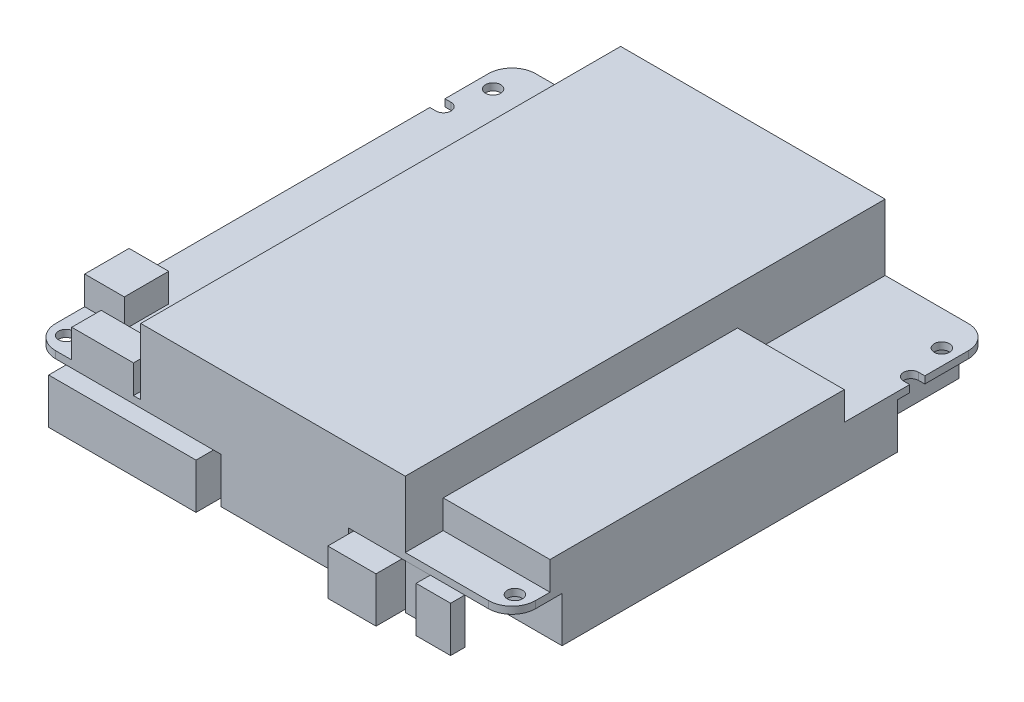
from build123d import *

# Parameters (mm, degrees)
SKETCH_1_R          = 1.6
EXTRUDE_1_DEPTH     = 1.5
SKETCH_2_W          = 56
SKETCH_2_H          = 101.6
EXTRUDE_2_DEPTH     = 14
SKETCH_3_W          = 22.6
SKETCH_3_H          = 62.30419098
SKETCH_3_W_2        = 13.073006245
SKETCH_3_H_2        = 6.218410599
SKETCH_3_W_3        = 8.391210828
SKETCH_3_H_3        = 9.399534429
EXTRUDE_3_DEPTH     = 6
SKETCH_4_W          = 6
SKETCH_4_H          = 11.3
EXTRUDE_4_DEPTH     = 13.4
SKETCH_5_W          = 1.75
SKETCH_5_H          = 8
CUT_EXTRUDE_1_DEPTH = 45
SKETCH_6_W          = 27
SKETCH_6_H          = 13
SKETCH_6_W_2        = 36
SKETCH_6_H_2        = 24
SKETCH_6_W_3        = 30
SKETCH_6_H_3        = 55
SKETCH_6_W_4        = 51
SKETCH_6_H_4        = 71
SKETCH_6_W_5        = 31.2
SKETCH_6_H_5        = 17
SKETCH_6_W_6        = 6.36
SKETCH_6_H_6        = 16
SKETCH_6_H_7        = 4
SKETCH_6_W_7        = 10.21
SKETCH_6_H_8        = 13.5
SKETCH_6_W_8        = 7.6
SKETCH_6_H_9        = 2.5
SKETCH_6_W_9        = 7.3
SKETCH_6_H_10       = 3
EXTRUDE_5_DEPTH     = 9.6


with BuildPart() as part:
    # Эскиз1 → Бобышка-Вытянуть1 (new body)
    with BuildSketch(Plane(origin=(0, 0, 0), x_dir=(1, 0, 0), z_dir=(0, 1, 0))):
        with BuildLine():
            Line((45.8, 50.8), (-45.8, 50.8))
            ThreePointArc((-45.8, 50.8), (-49.335533906, 49.335533906), (-50.8, 45.8))
            Line((-50.8, 45.8), (-50.8, 36.6))
            Line((-50.8, 36.6), (-49.5, 36.6))
            ThreePointArc((-49.5, 36.6), (-47.9, 35), (-49.5, 33.4))
            Line((-49.5, 33.4), (-50.8, 33.4))
            Line((-50.8, 33.4), (-50.8, -45.8))
            ThreePointArc((-50.8, -45.8), (-49.335533906, -49.335533906), (-45.8, -50.8))
            Line((-45.8, -50.8), (45.8, -50.8))
            ThreePointArc((45.8, -50.8), (49.335533906, -49.335533906), (50.8, -45.8))
            Line((50.8, -45.8), (50.8, 33.4))
            Line((50.8, 33.4), (49.5, 33.4))
            ThreePointArc((49.5, 33.4), (47.9, 35), (49.5, 36.6))
            Line((49.5, 36.6), (50.8, 36.6))
            Line((50.8, 36.6), (50.8, 45.8))
            ThreePointArc((50.8, 45.8), (49.335533906, 49.335533906), (45.8, 50.8))
        make_face()
        with Locations(Location((-47.5, -46.9, 0), (0, 0, 270))):
            Circle(SKETCH_1_R, mode=Mode.SUBTRACT)
        with Locations(Location((47.5, -46.9, 0), (0, 0, 270))):
            Circle(SKETCH_1_R, mode=Mode.SUBTRACT)
        with Locations(Location((-47.5, 43.5, 0), (0, 0, 270))):
            Circle(SKETCH_1_R, mode=Mode.SUBTRACT)
        with Locations(Location((47.5, 43.5, 0), (0, 0, 270))):
            Circle(SKETCH_1_R, mode=Mode.SUBTRACT)
    extrude(amount=EXTRUDE_1_DEPTH)

    # Эскиз2 → Бобышка-Вытянуть2 (add)
    with BuildSketch(Plane(origin=(0, 1.5, 0), x_dir=(1, 0, 0), z_dir=(0, 1, 0))):
        with Locations((0.2, 0)):
            Rectangle(SKETCH_2_W, SKETCH_2_H)
    extrude(amount=EXTRUDE_2_DEPTH)

    # Эскиз3 → Бобышка-Вытянуть3 (add)
    with BuildSketch(Plane(origin=(0, 1.5, 0), x_dir=(1, 0, 0), z_dir=(0, 1, 0))):
        with Locations((39.5, -11.607082664)):
            Rectangle(SKETCH_3_W, SKETCH_3_H)
        with Locations((-35.87228605, -47.690794701)):
            Rectangle(SKETCH_3_W_2, SKETCH_3_H_2)
        with Locations((-46.604394586, -34.970831235)):
            Rectangle(SKETCH_3_W_3, SKETCH_3_H_3)
    extrude(amount=EXTRUDE_3_DEPTH)

    # Эскиз4 → Бобышка-Вытянуть4 (add)
    with BuildSketch(Plane.XZ):
        with Locations((27.8, -45.15)):
            Rectangle(SKETCH_4_W, SKETCH_4_H)
    extrude(amount=EXTRUDE_4_DEPTH)

    # Эскиз5 → Вырез-Вытянуть1 (cut)
    with BuildSketch(Plane(origin=(0, 0, -50.8), x_dir=(-1, 0, 0), z_dir=(0, 0, -1))):
        with Locations((-26.531274607, 11.4)):
            Rectangle(SKETCH_5_W, SKETCH_5_H)
        with Locations((-24.581274607, 11.4)):
            Rectangle(SKETCH_5_W, SKETCH_5_H)
        with Locations((-22.631274607, 11.4)):
            Rectangle(SKETCH_5_W, SKETCH_5_H)
        with Locations((-20.681274607, 11.4)):
            Rectangle(SKETCH_5_W, SKETCH_5_H)
        with Locations((-18.731274607, 11.4)):
            Rectangle(SKETCH_5_W, SKETCH_5_H)
        with Locations((-16.781274607, 11.4)):
            Rectangle(SKETCH_5_W, SKETCH_5_H)
        with Locations((-14.831274607, 11.4)):
            Rectangle(SKETCH_5_W, SKETCH_5_H)
        with Locations((-12.881274607, 11.4)):
            Rectangle(SKETCH_5_W, SKETCH_5_H)
        with Locations((-10.931274607, 11.4)):
            Rectangle(SKETCH_5_W, SKETCH_5_H)
        with Locations((-8.981274607, 11.4)):
            Rectangle(SKETCH_5_W, SKETCH_5_H)
        with Locations((-7.031274607, 11.4)):
            Rectangle(SKETCH_5_W, SKETCH_5_H)
        with Locations((-5.081274607, 11.4)):
            Rectangle(SKETCH_5_W, SKETCH_5_H)
        with Locations((-3.131274607, 11.4)):
            Rectangle(SKETCH_5_W, SKETCH_5_H)
        with Locations((-1.181274607, 11.4)):
            Rectangle(SKETCH_5_W, SKETCH_5_H)
        with Locations((0.768725393, 11.4)):
            Rectangle(SKETCH_5_W, SKETCH_5_H)
        with Locations((2.718725393, 11.4)):
            Rectangle(SKETCH_5_W, SKETCH_5_H)
        with Locations((4.668725393, 11.4)):
            Rectangle(SKETCH_5_W, SKETCH_5_H)
        with Locations((6.618725393, 11.4)):
            Rectangle(SKETCH_5_W, SKETCH_5_H)
        with Locations((8.568725393, 11.4)):
            Rectangle(SKETCH_5_W, SKETCH_5_H)
        with Locations((10.518725393, 11.4)):
            Rectangle(SKETCH_5_W, SKETCH_5_H)
        with Locations((12.468725393, 11.4)):
            Rectangle(SKETCH_5_W, SKETCH_5_H)
        with Locations((14.418725393, 11.4)):
            Rectangle(SKETCH_5_W, SKETCH_5_H)
        with Locations((16.368725393, 11.4)):
            Rectangle(SKETCH_5_W, SKETCH_5_H)
        with Locations((18.318725393, 11.4)):
            Rectangle(SKETCH_5_W, SKETCH_5_H)
        with Locations((20.268725393, 11.4)):
            Rectangle(SKETCH_5_W, SKETCH_5_H)
        with Locations((22.218725393, 11.4)):
            Rectangle(SKETCH_5_W, SKETCH_5_H)
        with Locations((24.168725393, 11.4)):
            Rectangle(SKETCH_5_W, SKETCH_5_H)
        with Locations((26.118725393, 11.4)):
            Rectangle(SKETCH_5_W, SKETCH_5_H)
    extrude(amount=-CUT_EXTRUDE_1_DEPTH, mode=Mode.SUBTRACT)

    # Эскиз6 → Бобышка-Вытянуть5 (add)
    with BuildSketch(Plane.XZ):
        with Locations((30.3, -44.3)):
            Rectangle(SKETCH_6_W, SKETCH_6_H)
        with Locations((-23.8, -38.8)):
            Rectangle(SKETCH_6_W_2, SKETCH_6_H_2)
        with Locations((-35.8, 4.7)):
            Rectangle(SKETCH_6_W_3, SKETCH_6_H_3)
        with Locations((25.3, 4.7)):
            Rectangle(SKETCH_6_W_4, SKETCH_6_H_4)
        with Locations((-28, 46)):
            Rectangle(SKETCH_6_W_5, SKETCH_6_H_5)
        with Locations((-6.98, 32.8)):
            Rectangle(SKETCH_6_W_6, SKETCH_6_H_6)
        with Locations((2.7, 48.8)):
            Rectangle(SKETCH_6_W, SKETCH_6_H_7)
        with Locations((22.405, 49.55)):
            Rectangle(SKETCH_6_W_7, SKETCH_6_H_8)
        with Locations((32, 49.45)):
            Rectangle(SKETCH_6_W_8, SKETCH_6_H_9)
        with Locations((37.15, 52.3)):
            Rectangle(SKETCH_6_W_9, SKETCH_6_H_10)
    extrude(amount=EXTRUDE_5_DEPTH)


with BuildPart() as extrude_5_piece_1:
    # of the separate pieces the step leaves, piece 1, a body of its own (extrude_5_pieces)
    add(part.part.solids().sort_by_distance((49.5, 0, -33.4))[0])


with BuildPart() as extrude_5_piece_2:
    # of the separate pieces the step leaves, piece 2, a body of its own (extrude_5_pieces)
    add(part.part.solids().sort_by_distance((40.8, -9.6, 50.8))[0])


solid = Compound([extrude_5_piece_1.part, extrude_5_piece_2.part])
